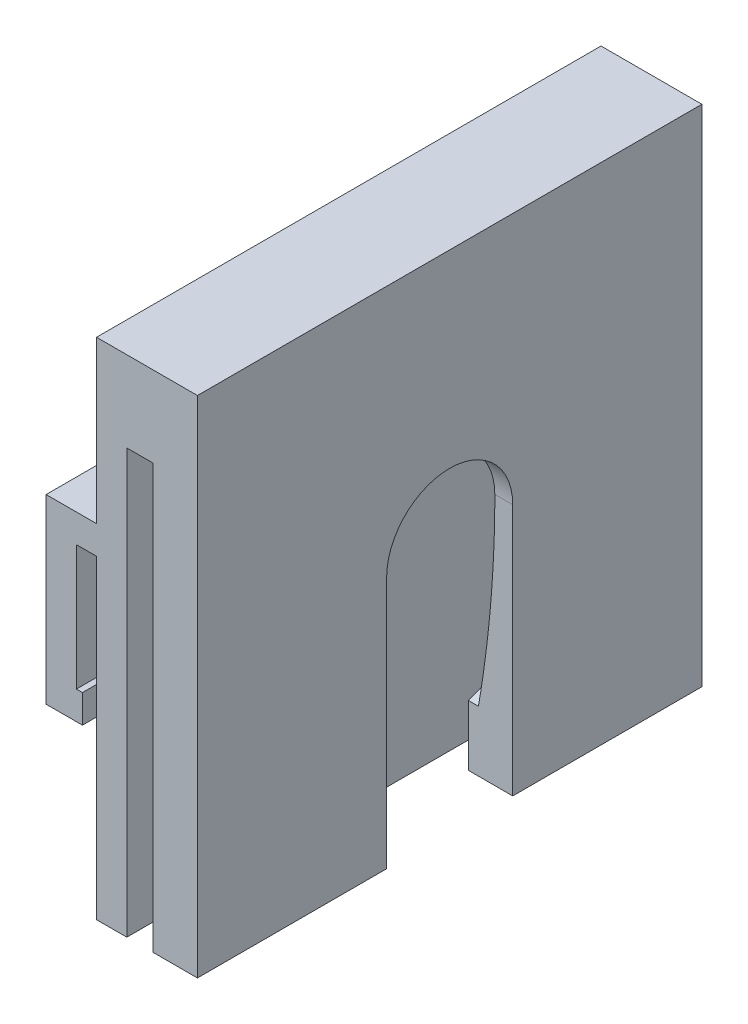
from build123d import *
from build123d.topology import SkipClean

# Parameters (mm, degrees)
SKETCH1_W           = 4
SKETCH1_H           = 9
BOSS_EXTRUDE1_DEPTH = 25
SKETCH2_W           = 1
SKETCH2_H           = 6
CUT_EXTRUDE1_DEPTH  = 26.480384612
SKETCH4_W           = 25
SKETCH4_H           = 25
BOSS_EXTRUDE2_DEPTH = 1.5
SKETCH5_W           = 25
SKETCH5_H           = 25
BOSS_EXTRUDE3_DEPTH = 3.5
SKETCH7_W           = 1.8
SKETCH7_H           = 25
CUT_EXTRUDE5_DEPTH  = 21
CUT_EXTRUDE6_START  = -1.7
CUT_EXTRUDE6_DEPTH  = 1.7
BOSS_EXTRUDE4_START = 0.5
BOSS_EXTRUDE4_DEPTH = 0.5
SKETCH11_W          = 0.7
SKETCH11_H          = 1.5
CUT_EXTRUDE7_DEPTH  = 29.486839086
SKETCH12_W          = 1
SKETCH12_H          = 6.2
CUT_EXTRUDE8_DEPTH  = 29.486839086


with BuildPart() as part:
    # Sketch1 → Boss-Extrude1 (new body)
    with BuildSketch(Plane.XY):
        Rectangle(SKETCH1_W, SKETCH1_H)
    extrude(amount=BOSS_EXTRUDE1_DEPTH)

    # Sketch2 → Cut-Extrude1 (cut, through all)
    with BuildSketch(Plane(origin=(0, 0, 0), x_dir=(-1, 0, 0), z_dir=(0, 0, -1))):
        Rectangle(SKETCH2_W, SKETCH2_H)
    extrude(amount=-CUT_EXTRUDE1_DEPTH, mode=Mode.SUBTRACT)

    # Sketch4 → Boss-Extrude2 (add)
    with BuildSketch(Plane(origin=(2, 0, 0), x_dir=(0, 0, -1), z_dir=(1, 0, 0))):
        with Locations((-12.5, 0)):
            Rectangle(SKETCH4_W, SKETCH4_H)
    extrude(amount=-BOSS_EXTRUDE2_DEPTH)

    # Sketch5 → Boss-Extrude3 (add)
    with BuildSketch(Plane(origin=(2, 0, 0), x_dir=(0, 0, -1), z_dir=(1, 0, 0))):
        with Locations((-12.5, 0)):
            Rectangle(SKETCH5_W, SKETCH5_H)
    extrude(amount=BOSS_EXTRUDE3_DEPTH)

    # Sketch6 → Cut-Revolve2 (revolve, cut)
    with BuildSketch(Plane(origin=(0, 0, 12.5), x_dir=(-1, 0, 0), z_dir=(0, 0, -1)), mode=Mode.PRIVATE) as cut_revolve2_sk:
        with BuildLine():
            Line((-2, 10), (-2, 0))
            Line((-2, 0), (-4.699928584, 0))
            ThreePointArc((-4.699928584, 0), (-4.474492757, 5.020205958), (-3.8, 10))
            Line((-3.8, 10), (-2, 10))
        make_face()
    revolve(cut_revolve2_sk.sketch.rotate(Axis((2.075, 0, 12.5), (-1, 0, 0)), 90), axis=Axis((2.075, 0, 12.5), (-1, 0, 0)), mode=Mode.SUBTRACT)

    # Sketch7 → Cut-Extrude5 (cut)
    with BuildSketch(Plane.XZ.offset(12.5)):
        with Locations((2.9, 12.5)):
            Rectangle(SKETCH7_W, SKETCH7_H)
    extrude(amount=-CUT_EXTRUDE5_DEPTH, mode=Mode.SUBTRACT)

    # Sketch8 → Cut-Extrude6 (cut)
    with BuildSketch(Plane(origin=(5.5, 0, 0), x_dir=(0, 0, -1), z_dir=(1, 0, 0)).offset(CUT_EXTRUDE6_START)):
        with BuildLine():
            Line((-9.375, 0), (-9.375, -12.5))
            ThreePointArc((-9.375, -12.5), (-12.5, -15.625), (-15.625, -12.5))
            Line((-15.625, -12.5), (-15.625, 0))
            ThreePointArc((-15.625, 0), (-12.5, 3.125), (-9.375, 0))
        make_face()
    extrude(amount=CUT_EXTRUDE6_DEPTH, mode=Mode.SUBTRACT)

    # Sketch9 → Boss-Extrude4 (add)
    with SkipClean():  # the faces are left unmerged after this step: merging them gives an invalid solid
        with BuildSketch(Plane.ZY.offset(-3.8).offset(BOSS_EXTRUDE4_START)):
            with BuildLine():
                Line((15.625, -9.499177596), (15.625, -12.5))
                Line((15.625, -12.5), (25, -12.5))
                Line((25, -12.5), (25, 8.5))
                Line((25, 8.5), (17.767826876, 8.5))
                ThreePointArc((17.767826876, 8.5), (22.429878362, -1.182165692), (15.625, -9.499177596))
            make_face()
            with BuildLine():
                Line((0, -12.5), (9.375, -12.5))
                Line((9.375, -12.5), (9.375, -9.499177596))
                ThreePointArc((9.375, -9.499177596), (2.570121638, -1.182165692), (7.232173124, 8.5))
                Line((7.232173124, 8.5), (0, 8.5))
                Line((0, 8.5), (0, -12.5))
            make_face()
        extrude(amount=-BOSS_EXTRUDE4_DEPTH)

    # Sketch11 → Cut-Extrude7 (cut, through all)
    with SkipClean():  # the faces are left unmerged after this step: merging them gives an invalid solid
        with BuildSketch(Plane(origin=(0, 0, 0), x_dir=(-1, 0, 0), z_dir=(0, 0, -1))):
            with Locations((-0.15, -3.75)):
                Rectangle(SKETCH11_W, SKETCH11_H)
        extrude(amount=-CUT_EXTRUDE7_DEPTH, mode=Mode.SUBTRACT)

    # Sketch12 → Cut-Extrude8 (cut, through all)
    with SkipClean():  # the faces are left unmerged after this step: merging them gives an invalid solid
        with BuildSketch(Plane(origin=(0, 0, 0), x_dir=(-1, 0, 0), z_dir=(0, 0, -1))):
            Rectangle(SKETCH12_W, SKETCH12_H)
        extrude(amount=-CUT_EXTRUDE8_DEPTH, mode=Mode.SUBTRACT)


solid = part.part
